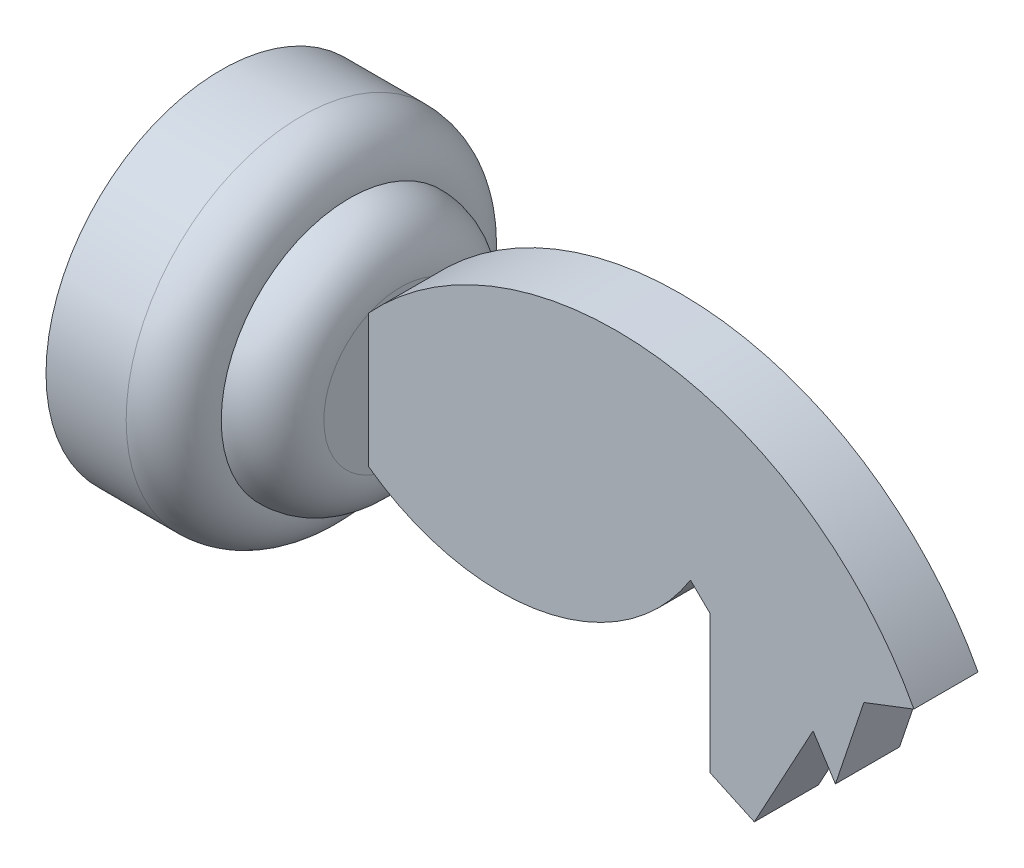
from build123d import *

# Parameters (mm, degrees)
EXTRUDE_2037_DEPTH = 2


with BuildPart() as part:
    # Sketch 227 → Повернуть1 (revolve)
    with BuildSketch(Plane.XY, mode=Mode.PRIVATE) as revolve_1_sk:
        with BuildLine():
            Line((0, 10.929858877), (0, 0))
            Line((0, 0), (1, 0))
            Line((1, 0), (1, 5.25))
            Line((1, 5.25), (3.5, 5.25))
            Line((3.5, 5.25), (3.5, 0))
            Line((3.5, 0), (8, 0))
            Line((8, 0), (8, 8))
            ThreePointArc((8, 8), (7.096901825, 10.076121155), (5, 10.929858877))
            Line((5, 10.929858877), (0, 10.929858877))
        make_face()
        with BuildLine():
            ThreePointArc((11.2, 4.8), (10.2627417, 7.0627417), (8, 8))
            Line((8, 8), (8, 0))
            Line((8, 0), (11.2, 0))
            Line((11.2, 0), (11.2, 2.4))
            Line((11.2, 2.4), (11.2, 4.8))
        make_face()
    revolve(revolve_1_sk.sketch.rotate(Axis((0, 0, 0), (1, 0, 0)), 90), axis=Axis((0, 0, 0), (1, 0, 0)))

    # Sketch 1020 → Extrude 2037 (add, symmetric)
    with BuildSketch(Plane.XY):
        with BuildLine():
            ThreePointArc((11.2, 4.4), (29.338267199, 10.995701086), (45.2, 0))
            Line((45.2, 0), (11.2, 0))
            Line((11.2, 0), (11.2, 4.4))
        make_face()
        with BuildLine():
            Line((31.263463773, 0), (11.2, 0))
            Line((11.2, 0), (11.2, -3.914978255))
            ThreePointArc((11.2, -3.914978255), (22.080678837, -6.30816882), (31.263463773, 0))
        make_face()
        Polygon((38.912013935, 0), (35.248695767, 0), (35.248695767, -11.07), (38.912013935, -4.32), align=None)
        Polygon((35.248695767, 0), (31.263463773, 0), (32.498964702, -1.197255299), (32.498964702, -9.797255299), (35.248695767, -11.07), align=None)
        Polygon((42.083014277, -1.2), (42.083014277, 0), (40.307542508, 0), (40.307542508, -6.49), align=None)
        Polygon((40.307542508, 0), (38.912013935, 0), (38.912013935, -4.32), (40.307542508, -6.49), align=None)
        Polygon((42.083014277, -1.2), (45.2, 0), (42.083014277, 0), align=None)
    extrude(amount=EXTRUDE_2037_DEPTH, both=True)


solid = part.part
